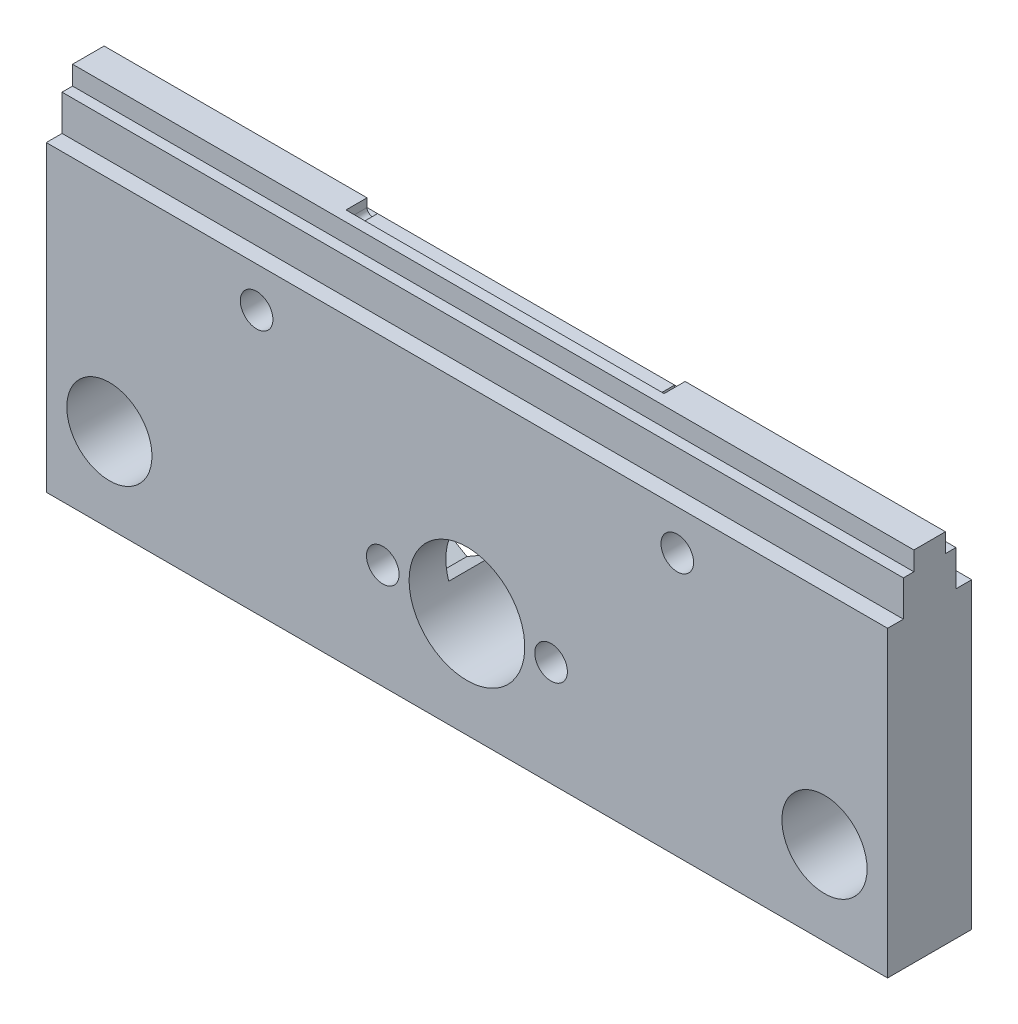
from build123d import *

# Parameters (mm, degrees)
SKETCH_2_W           = 80
SKETCH_2_H           = 34
SKETCH_2_R           = 4.05
EXTRUDE_1_DEPTH      = 8
CUT_EXTRUDE_2_DEPTH  = 88.292611371
SKETCH_5_R           = 1.55
CUT_EXTRUDE_3_DEPTH  = 88.292611371
CUT_EXTRUDE_5_DEPTH  = 4.5
SKETCH_11_R          = 1.55
CUT_EXTRUDE_7_DEPTH  = 88.292611371
CUT_EXTRUDE_11_DEPTH = 2
SKETCH_20_R          = 5.5
CUT_EXTRUDE_14_DEPTH = 88.292611371


with BuildPart() as part:
    # 草图2 → 凸台-拉伸1 (new body)
    with BuildSketch(Plane.XY):
        with Locations((40, 17)):
            Rectangle(SKETCH_2_W, SKETCH_2_H)
        with Locations((6, 8)):
            Circle(SKETCH_2_R, mode=Mode.SUBTRACT)
        with Locations((40, 10)):
            Circle(SKETCH_2_R, mode=Mode.SUBTRACT)
        with Locations((74, 8)):
            Circle(SKETCH_2_R, mode=Mode.SUBTRACT)
    extrude(amount=EXTRUDE_1_DEPTH)

    # 草图4 → 切除-拉伸2 (cut, through all)
    with BuildSketch(Plane(origin=(80, 0, 0), x_dir=(0, 0, -1), z_dir=(1, 0, 0))):
        Polygon((-1.5, 32.2), (-2.5, 32.2), (-2.5, 34), (0, 34), (0, 28.8), (-1.5, 28.8), align=None)
        Polygon((-6.5, 32.2), (-6.5, 28.8), (-8, 28.8), (-8, 34), (-5.5, 34), (-5.5, 32.2), align=None)
    extrude(amount=-CUT_EXTRUDE_2_DEPTH, mode=Mode.SUBTRACT)

    # 草图5 → 切除-拉伸3 (cut, through all)
    with BuildSketch(Plane.XY.offset(8)):
        with Locations((48, 10)):
            Circle(SKETCH_5_R)
        with Locations((32, 10)):
            Circle(SKETCH_5_R)
    extrude(amount=-CUT_EXTRUDE_3_DEPTH, mode=Mode.SUBTRACT)

    # 草图8 → 切除-拉伸5 (cut)
    with BuildSketch(Plane(origin=(0, 0, 0), x_dir=(-1, 0, 0), z_dir=(0, 0, -1))):
        Polygon((-45.15, 8.354551733), (-45.15, 11.645448267), (-48, 13.290896534), (-50.85, 11.645448267), (-50.85, 8.354551733), (-48, 6.709103466), align=None)
        Polygon((-29.15, 8.354551733), (-29.15, 11.645448267), (-32, 13.290896534), (-34.85, 11.645448267), (-34.85, 8.354551733), (-32, 6.709103466), align=None)
    extrude(amount=-CUT_EXTRUDE_5_DEPTH, mode=Mode.SUBTRACT)

    # 草图11 → 切除-拉伸7 (cut, through all)
    with BuildSketch(Plane(origin=(0, 0, 0), x_dir=(-1, 0, 0), z_dir=(0, 0, -1))):
        with Locations((-60, 25)):
            Circle(SKETCH_11_R)
        with Locations((-20, 25)):
            Circle(SKETCH_11_R)
    extrude(amount=-CUT_EXTRUDE_7_DEPTH, mode=Mode.SUBTRACT)

    # 草图19 → 切除-拉伸11 (cut)
    with BuildSketch(Plane(origin=(0, 0, 2.5), x_dir=(-1, 0, 0), z_dir=(0, 0, -1))):
        with BuildLine():
            Line((-25, 34), (-55.247938178, 34))
            Line((-55.247938178, 34), (-55.247938178, 33.2))
            ThreePointArc((-55.247938178, 33.2), (-54.747938178, 32.7), (-54.247938178, 33.2))
            Line((-54.247938178, 33.2), (-26, 33.2))
            ThreePointArc((-26, 33.2), (-25.5, 32.7), (-25, 33.2))
            Line((-25, 33.2), (-25, 34))
        make_face()
    extrude(amount=-CUT_EXTRUDE_11_DEPTH, mode=Mode.SUBTRACT)

    # 草图20 → 切除-拉伸14 (cut, through all)
    with BuildSketch(Plane(origin=(0, 0, 0), x_dir=(-1, 0, 0), z_dir=(0, 0, -1))):
        with Locations((-40, 10)):
            Circle(SKETCH_20_R)
    extrude(amount=-CUT_EXTRUDE_14_DEPTH, mode=Mode.SUBTRACT)


solid = part.part
